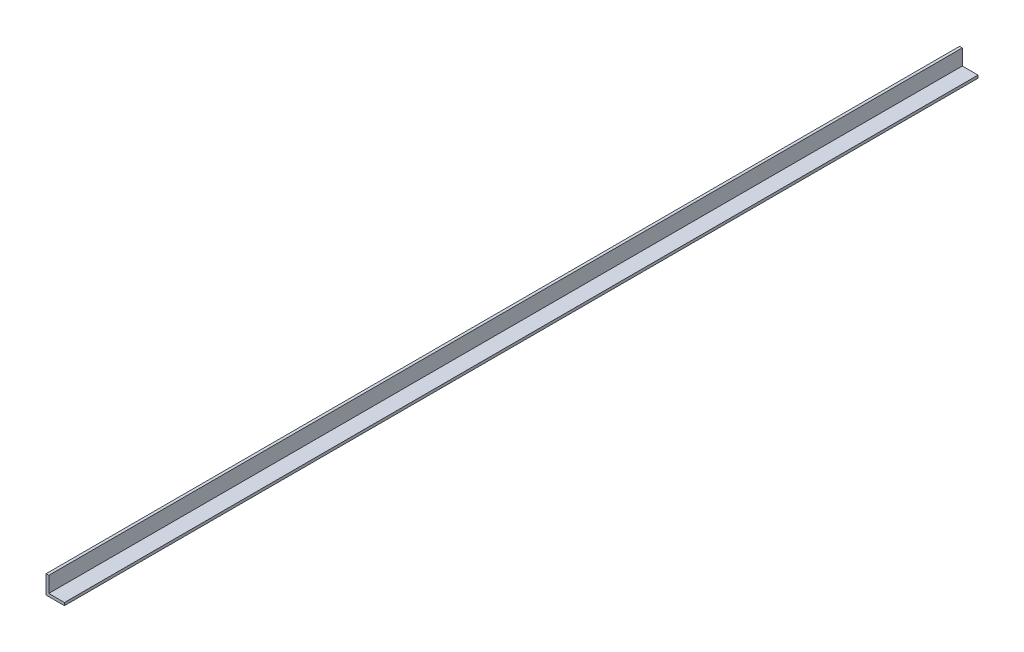
from build123d import *

# Parameters (mm, degrees)
BOSS_EXTRUDE1_DEPTH = 990


with BuildPart() as part:
    # Sketch1 → Boss-Extrude1 (new body)
    with BuildSketch(Plane.XY):
        Polygon((0, 20), (0, 0), (20, 0), (20, 3), (3, 3), (3, 20), align=None)
    extrude(amount=BOSS_EXTRUDE1_DEPTH)


solid = part.part
